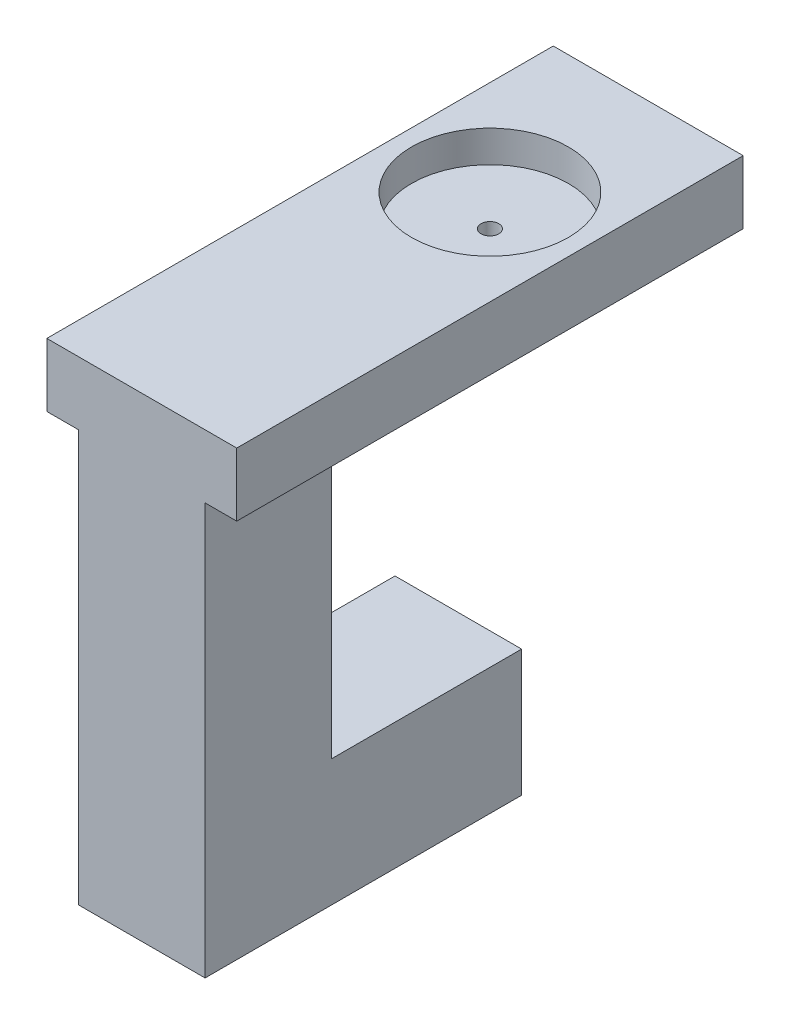
from build123d import *

# Parameters (mm, degrees)
CROQUIS2_W                   = 20
CROQUIS2_H                   = 20
SALIENTE_EXTRUIR1_DEPTH      = 50
CROQUIS3_W                   = 20
CROQUIS3_H                   = 20
SALIENTE_EXTRUIR2_DEPTH      = 51
SALIENTE_EXTRUIR4_DEPTH      = 60
SALIENTE_EXTRUIR4_DEPTH_BACK = 20
CROQUIS7_W                   = 30
CROQUIS7_H                   = 10
CROQUIS8_R                   = 1.4
CORTAR_EXTRUIR2_DEPTH        = 60
CROQUIS9_R                   = 12.395
CORTAR_EXTRUIR3_DEPTH        = 5


with BuildPart() as part:
    # Croquis2 → Saliente-Extruir1 (new body)
    with BuildSketch(Plane.XY):
        Rectangle(CROQUIS2_W, CROQUIS2_H)
    extrude(amount=SALIENTE_EXTRUIR1_DEPTH)

    # Croquis3 → Saliente-Extruir2 (add)
    with BuildSketch(Plane(origin=(0, 10, 0), x_dir=(1, 0, 0), z_dir=(0, 1, 0))):
        with Locations((0, -40)):
            Rectangle(CROQUIS3_W, CROQUIS3_H)
    extrude(amount=SALIENTE_EXTRUIR2_DEPTH)

    # Croquis7 → Saliente-Extruir4 (add, two sides: drawn at the far end of the back side and taken through both)
    with BuildSketch(Plane(origin=(0, 0, 30), x_dir=(-1, 0, 0), z_dir=(0, 0, -1)).offset(-SALIENTE_EXTRUIR4_DEPTH_BACK)):
        with Locations((0, 60)):
            Rectangle(CROQUIS7_W, CROQUIS7_H)
    extrude(amount=SALIENTE_EXTRUIR4_DEPTH + SALIENTE_EXTRUIR4_DEPTH_BACK)

    # Croquis8 → Cortar-Extruir2 (cut)
    with BuildSketch(Plane(origin=(0, 65, 0), x_dir=(1, 0, 0), z_dir=(0, 1, 0))):
        with Locations(Location((0, 5, 0), (0, 0, 270))):
            Circle(CROQUIS8_R)
    extrude(amount=-CORTAR_EXTRUIR2_DEPTH, mode=Mode.SUBTRACT)

    # Croquis9 → Cortar-Extruir3 (cut)
    with BuildSketch(Plane(origin=(0, 65, 0), x_dir=(1, 0, 0), z_dir=(0, 1, 0))):
        with Locations(Location((0, 5, 0), (0, 0, 270))):
            Circle(CROQUIS9_R)
    extrude(amount=-CORTAR_EXTRUIR3_DEPTH, mode=Mode.SUBTRACT)


solid = part.part
